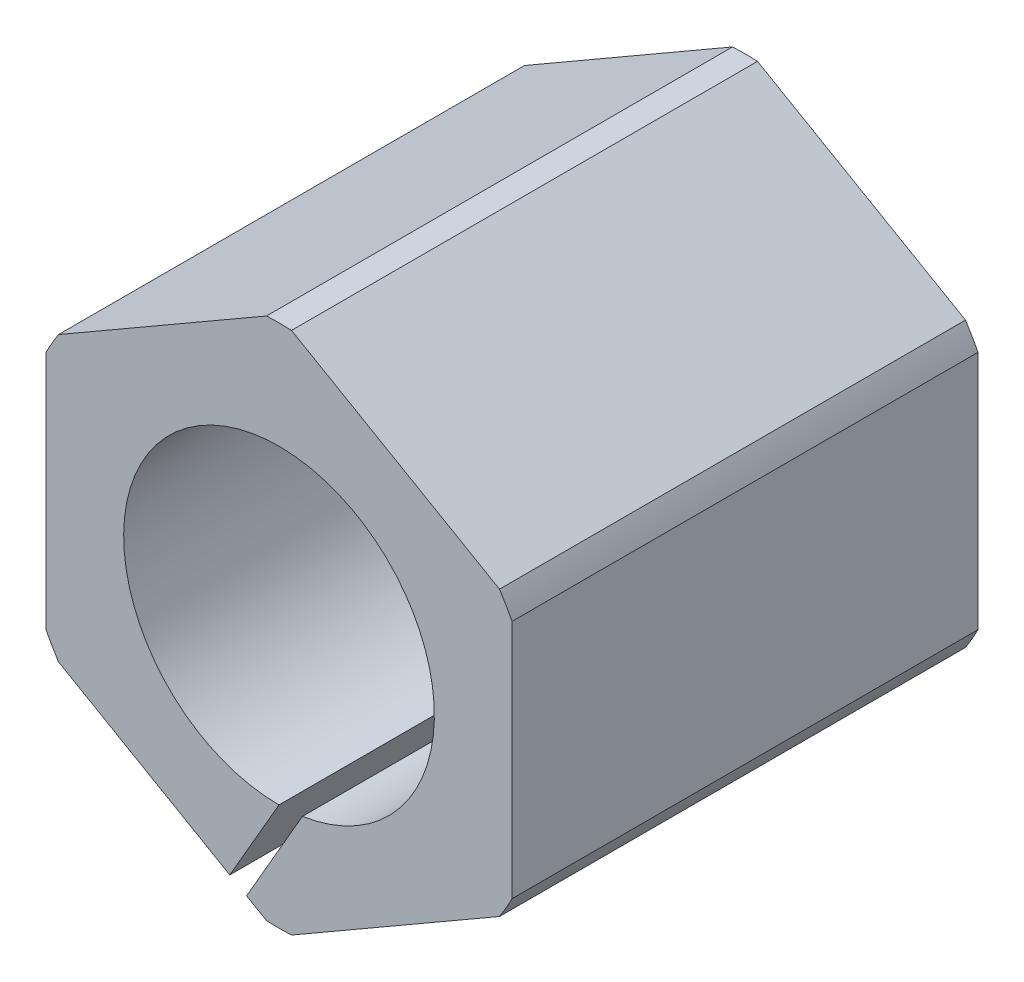
from build123d import *

# Parameters (mm, degrees)
SKETCH1_R         = 6.35
EXTRUDE1_DEPTH    = 9.525
SKETCH2_OUTSIDE_W = 28.006
SKETCH2_OUTSIDE_H = 30.954
SKETCH2_OUTSIDE_R = 10.715625
EXTRUDE2_DEPTH    = 24.970724332
EXTRUDE3_DEPTH    = 24.842247045


with BuildPart() as part:
    # Sketch1 → Extrude1 (new, symmetric)
    with BuildSketch(Plane.XY):
        Polygon((0, 10.998522628), (-9.525, 5.499261314), (-9.525, -5.499261314), (0, -10.998522628), (9.525, -5.499261314), (9.525, 5.499261314), align=None)
        with Locations(Location((0, 0, 0), (0, 0, 180))):
            Circle(SKETCH1_R, mode=Mode.SUBTRACT)
    extrude(amount=EXTRUDE1_DEPTH, both=True)

    # Sketch2 outside → Extrude2 (cut, through all)
    with BuildSketch(Plane.XY.offset(9.525)):
        Rectangle(SKETCH2_OUTSIDE_W, SKETCH2_OUTSIDE_H)
        Circle(SKETCH2_OUTSIDE_R, mode=Mode.SUBTRACT)
    extrude(amount=-EXTRUDE2_DEPTH, mode=Mode.SUBTRACT)

    # Sketch3 → Extrude3 (cut, through all)
    with BuildSketch(Plane.XY.offset(9.525)):
        Polygon((3.437038321, -1.984375), (-1.325461679, -10.233266971), (-2.012869343, -9.836391971), (2.749630657, -1.5875), align=None)
    extrude(amount=-EXTRUDE3_DEPTH, mode=Mode.SUBTRACT)


solid = part.part
